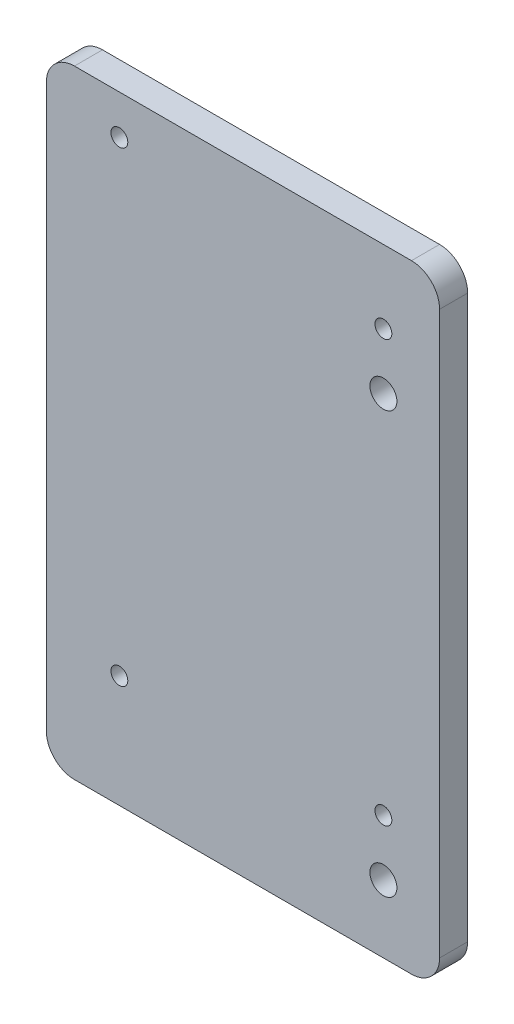
from build123d import *

# Parameters (mm, degrees)
SKETCH1_W           = 70
SKETCH1_H           = 110
SKETCH1_R           = 1.5
SKETCH1_R_2         = 2.4
BOSS_EXTRUDE1_DEPTH = 5
FILLET1_R           = 5


with BuildPart() as part:
    # Sketch1 → Boss-Extrude1 (new body)
    with BuildSketch(Plane.XY):
        Rectangle(SKETCH1_W, SKETCH1_H)
        with Locations((25, 42)):
            Circle(SKETCH1_R, mode=Mode.SUBTRACT)
        with Locations((25, -33)):
            Circle(SKETCH1_R, mode=Mode.SUBTRACT)
        with Locations((25, 32)):
            Circle(SKETCH1_R_2, mode=Mode.SUBTRACT)
        with Locations((25, -43)):
            Circle(SKETCH1_R_2, mode=Mode.SUBTRACT)
        with Locations((-22, 48)):
            Circle(SKETCH1_R, mode=Mode.SUBTRACT)
        with Locations((-22, -35)):
            Circle(SKETCH1_R, mode=Mode.SUBTRACT)
    extrude(amount=BOSS_EXTRUDE1_DEPTH)

    # Fillet1
    fillet1_edges = [part.edges().sort_by_distance(p)[0] for p in [
        (35, -55, 2.5),
        (-35, -55, 2.5),
        (-35, 55, 2.5),
        (35, 55, 2.5),
    ]]
    fillet(fillet1_edges, radius=FILLET1_R)


solid = part.part
